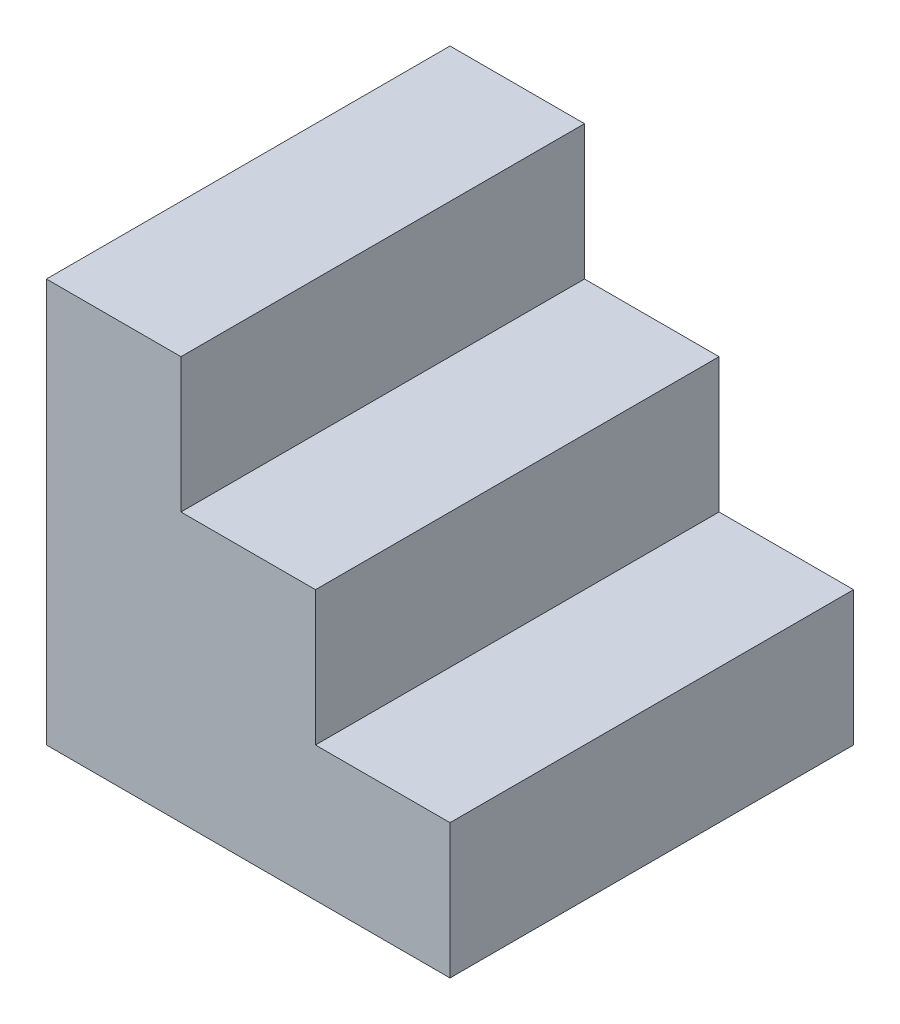
from build123d import *

# Parameters (mm, degrees)
EXTRUSION1_DEPTH = 100


with BuildPart() as part:
    # Esquisse1 → Extrusion1 (new body)
    with BuildSketch(Plane.XY):
        Polygon((33.333333333, 100), (0, 100), (0, 0), (100, 0), (100, 33.333333333), (66.666666667, 33.333333333), (66.666666667, 66.666666667), (33.333333333, 66.666666667), align=None)
    extrude(amount=EXTRUSION1_DEPTH)


solid = part.part
